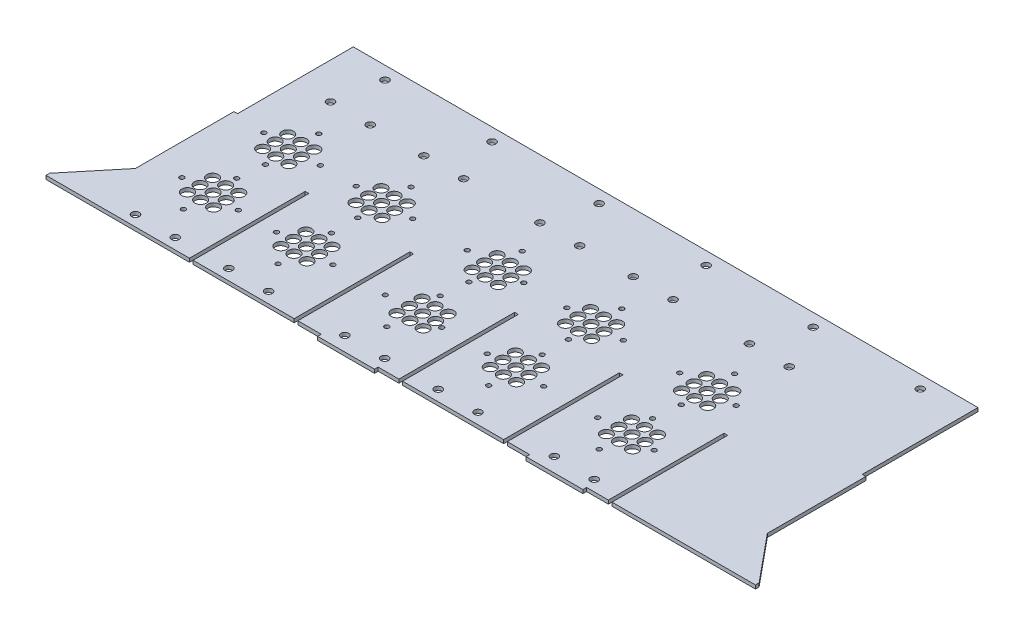
from build123d import *

# Parameters (mm, degrees)
SKETCH1_W            = 554.9050502
SKETCH1_H            = 3.175
BOSS_EXTRUDE1_DEPTH  = 232.6
SKETCH7_R            = 3.302
CUT_EXTRUDE4_DEPTH   = 363.067320134
SKETCH6_W            = 50
SKETCH6_H            = 3.175
BOSS_EXTRUDE2_DEPTH  = 3.175
LPATTERN1_COUNT      = 6
LPATTERN1_PITCH      = 93.98
SKETCH2_W            = 3.175
SKETCH2_H            = 101.6
CUT_EXTRUDE5_DEPTH   = 365.115139667
BOSS_EXTRUDE3_DEPTH  = 3.175
SKETCH13_W           = 3.175
SKETCH13_H           = 101.6
CUT_EXTRUDE6_DEPTH   = 391.672538732
LPATTERN2_COUNT      = 5
LPATTERN2_PITCH      = 91.9550104
SKETCH20_R           = 2
CUT_EXTRUDE8_DEPTH   = 391.775677212
SKETCH21_R           = 5
CUT_EXTRUDE9_DEPTH   = 391.672538732
LPATTERN5_COUNT      = 3
LPATTERN5_PITCH      = 183.896
SKETCH22_R           = 5
CUT_EXTRUDE10_DEPTH  = 391.672538732
LPATTERN6_COUNT      = 2
LPATTERN6_PITCH      = 183.896
M6_CLEARANCE_HOLE2_D = 6.6
LPATTERN7_COUNT      = 2
LPATTERN7_PITCH      = 183.896
M6_CLEARANCE_HOLE3_D = 6.6


with BuildPart() as part:
    # Sketch1 → Boss-Extrude1 (new body)
    with BuildSketch(Plane.XY):
        Rectangle(SKETCH1_W, SKETCH1_H)
    extrude(amount=BOSS_EXTRUDE1_DEPTH)

    # Sketch7 → Cut-Extrude4 (cut, through all)
    with BuildSketch(Plane(origin=(0, -1.5875, 0), x_dir=(-1, 0, 0), z_dir=(0, -1, 0))):
        with Locations((-234.7805251, -11.29165)):
            Circle(SKETCH7_R)
    cut_extrude4 = extrude(amount=-CUT_EXTRUDE4_DEPTH, mode=Mode.SUBTRACT)

    # Sketch6 → Boss-Extrude2 (add)
    with BuildSketch(Plane.XY.offset(232.6)):
        with Locations((138.15253015, 0)):
            Rectangle(SKETCH6_W, SKETCH6_H)
        with Locations((-44.8055431, 0)):
            Rectangle(SKETCH6_W, SKETCH6_H)
    extrude(amount=BOSS_EXTRUDE2_DEPTH)

    # LPattern1: Cut-Extrude4 ×6
    with Locations(*[(-i * LPATTERN1_PITCH, 0, 0) for i in range(1, LPATTERN1_COUNT)]):
        add(cut_extrude4, mode=Mode.SUBTRACT)

    # Sketch2 → Cut-Extrude5 (cut, through all)
    with BuildSketch(Plane(origin=(0, 1.5875, 0), x_dir=(1, 0, 0), z_dir=(0, 1, 0))):
        with Locations((275.8650251, -50.8)):
            Rectangle(SKETCH2_W, SKETCH2_H)
        with Locations((-275.8650251, -50.8)):
            Rectangle(SKETCH2_W, SKETCH2_H)
    extrude(amount=-CUT_EXTRUDE5_DEPTH, mode=Mode.SUBTRACT)

    # Sketch12 → Boss-Extrude3 (add)
    with BuildSketch(Plane(origin=(0, 1.5875, 0), x_dir=(1, 0, 0), z_dir=(0, 1, 0))):
        Polygon((-311.4885251, -232.6), (-277.4525251, -232.6), (-277.4525251, -188.15), (-311.4885251, -229.425), align=None)
    boss_extrude3 = extrude(amount=-BOSS_EXTRUDE3_DEPTH)

    # Mirror1: Boss-Extrude3 across plane
    add(boss_extrude3.mirror(Plane(origin=(0, 0, 0), x_dir=(0, 0, 1), z_dir=(1, 0, 0))))

    # Sketch13 → Cut-Extrude6 (cut, through all)
    with BuildSketch(Plane.XZ.offset(1.5875)):
        with Locations((-183.9100147, 181.8)):
            Rectangle(SKETCH13_W, SKETCH13_H)
    cut_extrude6 = extrude(amount=-CUT_EXTRUDE6_DEPTH, mode=Mode.SUBTRACT)

    # LPattern2: Cut-Extrude6 ×5
    with Locations(*[(i * LPATTERN2_PITCH, 0, 0) for i in range(1, LPATTERN2_COUNT)]):
        add(cut_extrude6, mode=Mode.SUBTRACT)

    # Sketch20 → Cut-Extrude8 (cut, through all)
    with BuildSketch(Plane(origin=(0, 7.935000001, 0), x_dir=(1, 0, 0), z_dir=(0, 1, 0))):
        with Locations((-198.590860636, -104.637084158)):
            Circle(SKETCH20_R)
        with Locations((-223.376394541, -128.058151968)):
            Circle(SKETCH20_R)
        with Locations((-248.161928446, -104.637084158)):
            Circle(SKETCH20_R)
        with Locations((-223.376394541, -81.216016348)):
            Circle(SKETCH20_R)
        with Locations((-167.108578446, -174.6221)):
            Circle(SKETCH20_R)
        with Locations((-142.323044541, -198.04316781)):
            Circle(SKETCH20_R)
        with Locations((-142.323044541, -151.20103219)):
            Circle(SKETCH20_R)
        with Locations((-117.537510636, -174.6221)):
            Circle(SKETCH20_R)
        with Locations((-21.999097153, -174.6221)):
            Circle(SKETCH20_R)
        with Locations((-46.784631058, -198.04316781)):
            Circle(SKETCH20_R)
        with Locations((-46.784631058, -151.20103219)):
            Circle(SKETCH20_R)
        with Locations((-71.570164963, -174.6221)):
            Circle(SKETCH20_R)
        with Locations((-117.537510636, -104.637084158)):
            Circle(SKETCH20_R)
        with Locations((-142.323044541, -128.058151968)):
            Circle(SKETCH20_R)
        with Locations((-167.108578446, -104.637084158)):
            Circle(SKETCH20_R)
        with Locations((-142.323044541, -81.216016348)):
            Circle(SKETCH20_R)
        with Locations((-200.625097153, -174.6221)):
            Circle(SKETCH20_R)
        with Locations((-225.410631058, -198.04316781)):
            Circle(SKETCH20_R)
        with Locations((-250.196164963, -174.6221)):
            Circle(SKETCH20_R)
        with Locations((-225.410631058, -151.20103219)):
            Circle(SKETCH20_R)
        with Locations((-44.750394541, -128.058151968)):
            Circle(SKETCH20_R)
        with Locations((-19.964860636, -104.637084158)):
            Circle(SKETCH20_R)
        with Locations((-44.750394541, -81.216016348)):
            Circle(SKETCH20_R)
        with Locations((-69.535928446, -104.637084158)):
            Circle(SKETCH20_R)
        with Locations((42.676955459, -198.04316781)):
            Circle(SKETCH20_R)
        with Locations((67.462489364, -174.6221)):
            Circle(SKETCH20_R)
        with Locations((42.676955459, -151.20103219)):
            Circle(SKETCH20_R)
        with Locations((17.891421554, -174.6221)):
            Circle(SKETCH20_R)
        with Locations((42.676955459, -128.058151968)):
            Circle(SKETCH20_R)
        with Locations((17.891421554, -104.637084158)):
            Circle(SKETCH20_R)
        with Locations((67.462489364, -104.637084158)):
            Circle(SKETCH20_R)
        with Locations((42.676955459, -81.216016348)):
            Circle(SKETCH20_R)
        with Locations((139.715368942, -198.04316781)):
            Circle(SKETCH20_R)
        with Locations((114.929835037, -174.6221)):
            Circle(SKETCH20_R)
        with Locations((164.500902847, -174.6221)):
            Circle(SKETCH20_R)
        with Locations((139.715368942, -151.20103219)):
            Circle(SKETCH20_R)
        with Locations((166.535139364, -104.637084158)):
            Circle(SKETCH20_R)
        with Locations((141.749605459, -128.058151968)):
            Circle(SKETCH20_R)
        with Locations((116.964071554, -104.637084158)):
            Circle(SKETCH20_R)
        with Locations((141.749605459, -81.216016348)):
            Circle(SKETCH20_R)
    extrude(amount=-CUT_EXTRUDE8_DEPTH, mode=Mode.SUBTRACT)

    # Sketch21 → Cut-Extrude9 (cut, through all)
    with BuildSketch(Plane(origin=(0, 1.5875, 0), x_dir=(1, 0, 0), z_dir=(0, 1, 0))):
        with Locations((-224.991497081, -95.343337061)):
            Circle(SKETCH21_R)
        with Locations((-236.491497081, -95.343337061)):
            Circle(SKETCH21_R)
        with Locations((-236.491497081, -106.343337061)):
            Circle(SKETCH21_R)
        with Locations((-236.491497081, -117.343337061)):
            Circle(SKETCH21_R)
        with Locations((-213.491497081, -106.343337061)):
            Circle(SKETCH21_R)
        with Locations((-224.991497081, -106.343337061)):
            Circle(SKETCH21_R)
        with Locations((-224.991497081, -117.343337061)):
            Circle(SKETCH21_R)
        with Locations((-213.491497081, -117.343337061)):
            Circle(SKETCH21_R)
        with Locations((-213.491497081, -95.343337061)):
            Circle(SKETCH21_R)
        with Locations((-236.491497081, -183.343337061)):
            Circle(SKETCH21_R)
        with Locations((-224.991497081, -183.343337061)):
            Circle(SKETCH21_R)
        with Locations((-213.491497081, -183.343337061)):
            Circle(SKETCH21_R)
        with Locations((-213.491497081, -172.343337061)):
            Circle(SKETCH21_R)
        with Locations((-213.491497081, -161.343337061)):
            Circle(SKETCH21_R)
        with Locations((-224.991497081, -161.343337061)):
            Circle(SKETCH21_R)
        with Locations((-224.991497081, -172.343337061)):
            Circle(SKETCH21_R)
        with Locations((-236.491497081, -172.343337061)):
            Circle(SKETCH21_R)
        with Locations((-236.491497081, -161.343337061)):
            Circle(SKETCH21_R)
    cut_extrude9 = extrude(amount=-CUT_EXTRUDE9_DEPTH, mode=Mode.SUBTRACT)

    # LPattern5: Cut-Extrude9 ×3
    with Locations(*[(i * LPATTERN5_PITCH, 0, 0) for i in range(1, LPATTERN5_COUNT)]):
        add(cut_extrude9, mode=Mode.SUBTRACT)

    # Sketch22 → Cut-Extrude10 (cut, through all)
    with BuildSketch(Plane(origin=(0, 1.5875, 0), x_dir=(1, 0, 0), z_dir=(0, 1, 0))):
        with Locations((-131.533994162, -117.343337061)):
            Circle(SKETCH22_R)
        with Locations((-143.033994162, -117.343337061)):
            Circle(SKETCH22_R)
        with Locations((-154.533994162, -117.343337061)):
            Circle(SKETCH22_R)
        with Locations((-154.533994162, -106.343337061)):
            Circle(SKETCH22_R)
        with Locations((-143.033994162, -106.343337061)):
            Circle(SKETCH22_R)
        with Locations((-131.533994162, -106.343337061)):
            Circle(SKETCH22_R)
        with Locations((-131.533994162, -95.343337061)):
            Circle(SKETCH22_R)
        with Locations((-143.033994162, -95.343337061)):
            Circle(SKETCH22_R)
        with Locations((-154.533994162, -95.343337061)):
            Circle(SKETCH22_R)
        with Locations((-131.533994162, -183.343337061)):
            Circle(SKETCH22_R)
        with Locations((-131.533994162, -172.343337061)):
            Circle(SKETCH22_R)
        with Locations((-131.533994162, -161.343337061)):
            Circle(SKETCH22_R)
        with Locations((-143.033994162, -161.343337061)):
            Circle(SKETCH22_R)
        with Locations((-143.033994162, -172.343337061)):
            Circle(SKETCH22_R)
        with Locations((-143.033994162, -183.343337061)):
            Circle(SKETCH22_R)
        with Locations((-154.533994162, -183.343337061)):
            Circle(SKETCH22_R)
        with Locations((-154.533994162, -172.343337061)):
            Circle(SKETCH22_R)
        with Locations((-154.533994162, -161.343337061)):
            Circle(SKETCH22_R)
    cut_extrude10 = extrude(amount=-CUT_EXTRUDE10_DEPTH, mode=Mode.SUBTRACT)

    # LPattern6: Cut-Extrude10 ×2
    with Locations(*[(i * LPATTERN6_PITCH, 0, 0) for i in range(1, LPATTERN6_COUNT)]):
        add(cut_extrude10, mode=Mode.SUBTRACT)

    # M6 Clearance Hole2 (through all)
    with Locations(Plane(origin=(0, 1.5875, 0), x_dir=(1, 0, 0), z_dir=(0, 1, 0))):
        with Locations((-160.496494162, -223.075), (-207.528997081, -51.825), (-242.453997081, -51.825), (-207.528997081, -223.075), (-242.453997081, -223.075), (-125.571494162, -51.825), (-160.496494162, -51.825), (-125.571494162, -223.075)):
            m6_clearance_hole2 = Hole(M6_CLEARANCE_HOLE2_D / 2)

    # LPattern7: M6 Clearance Hole2 ×2
    with Locations(*[(i * LPATTERN7_PITCH, 0, 0) for i in range(1, LPATTERN7_COUNT)]):
        add(m6_clearance_hole2, mode=Mode.SUBTRACT)

    # M6 Clearance Hole3 (through all)
    with Locations(Plane(origin=(0, 1.5875, 0), x_dir=(1, 0, 0), z_dir=(0, 1, 0))):
        with Locations((125.423008674, -51.825), (160.348008674, -51.825), (125.423008674, -223.075), (160.348008674, -223.075)):
            Hole(M6_CLEARANCE_HOLE3_D / 2)


solid = part.part
